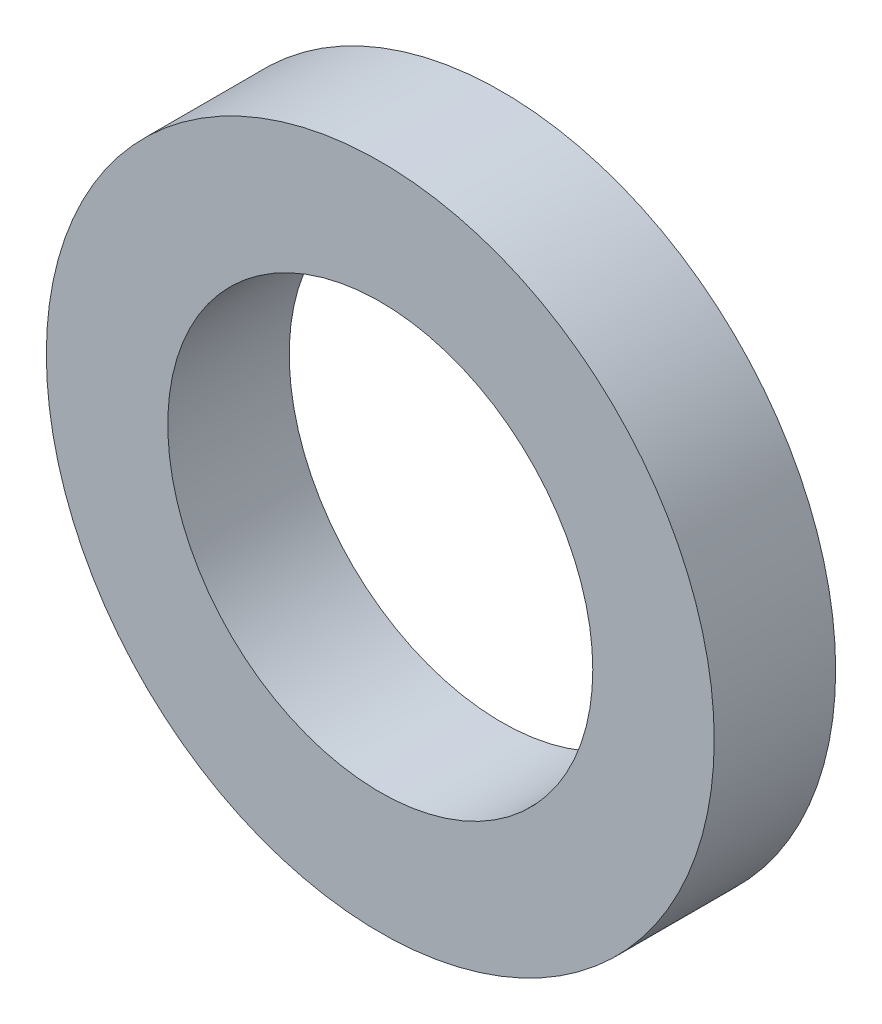
from build123d import *

# Parameters (mm, degrees)
SKETCH1_R           = 34.925
SKETCH1_R_2         = 22.225
BOSS_EXTRUDE1_DEPTH = 12.7


with BuildPart() as part:
    # Sketch1 → Boss-Extrude1 (new body)
    with BuildSketch(Plane.XY):
        Circle(SKETCH1_R)
        Circle(SKETCH1_R_2, mode=Mode.SUBTRACT)
    extrude(amount=BOSS_EXTRUDE1_DEPTH)


solid = part.part
